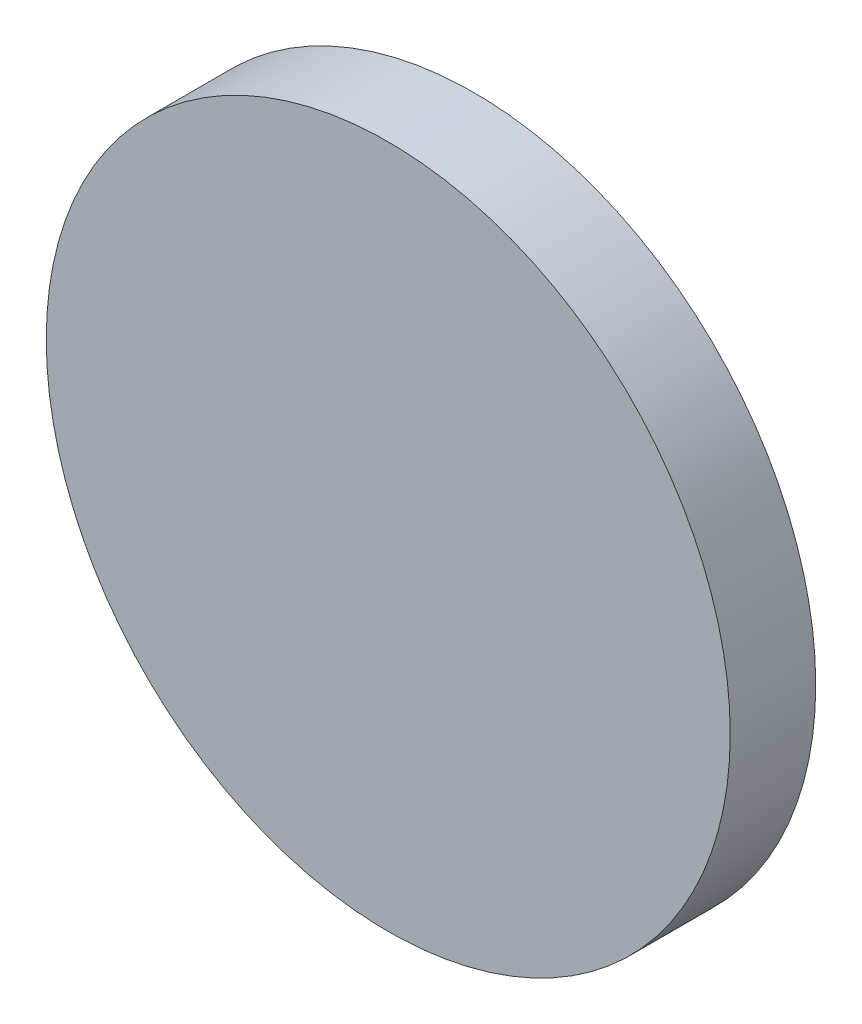
from build123d import *

# Parameters (mm, degrees)
ESBO_O1_R                = 8
RESSALTO_EXTRUS_O1_DEPTH = 2


with BuildPart() as part:
    # Esboço1 → Ressalto-extrusão1 (new body)
    with BuildSketch(Plane.XY):
        Circle(ESBO_O1_R)
    extrude(amount=RESSALTO_EXTRUS_O1_DEPTH)


solid = part.part
